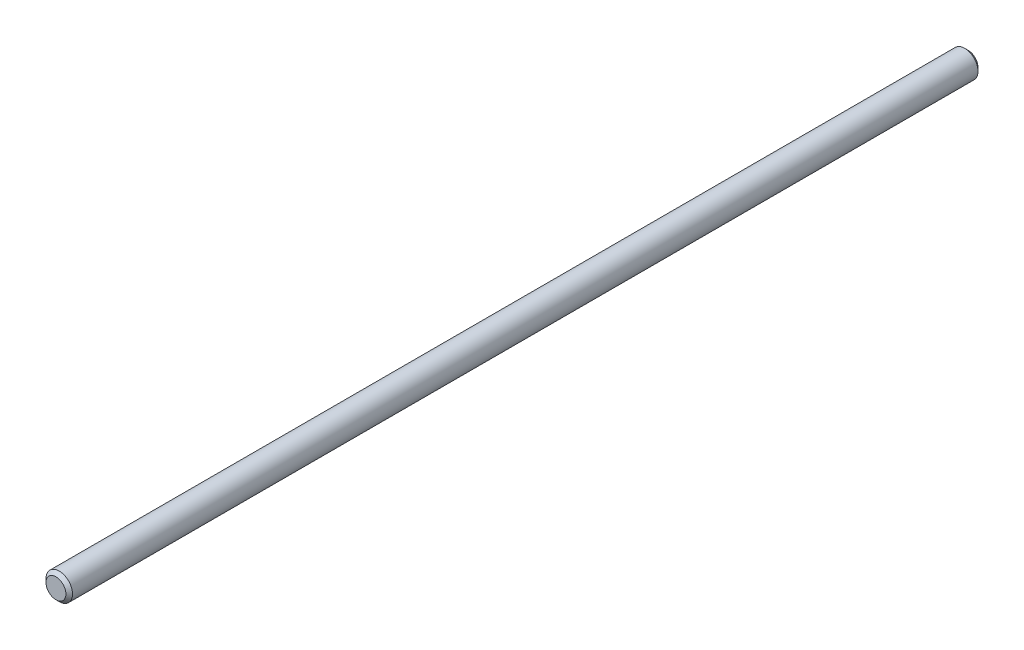
from build123d import *

# Parameters (mm, degrees)
SKETCH1_R           = 4
BOSS_EXTRUDE1_DEPTH = 275
CHAMFER1_SIZE       = 1


with BuildPart() as part:
    # Sketch1 → Boss-Extrude1 (new body)
    with BuildSketch(Plane.XY):
        Circle(SKETCH1_R)
    extrude(amount=BOSS_EXTRUDE1_DEPTH)

    # Chamfer1
    chamfer1_edges = [part.edges().sort_by_distance(p)[0] for p in [
        (-4, 0, 0),
        (-4, 0, 275),
    ]]
    chamfer(chamfer1_edges, length=CHAMFER1_SIZE)


solid = part.part
